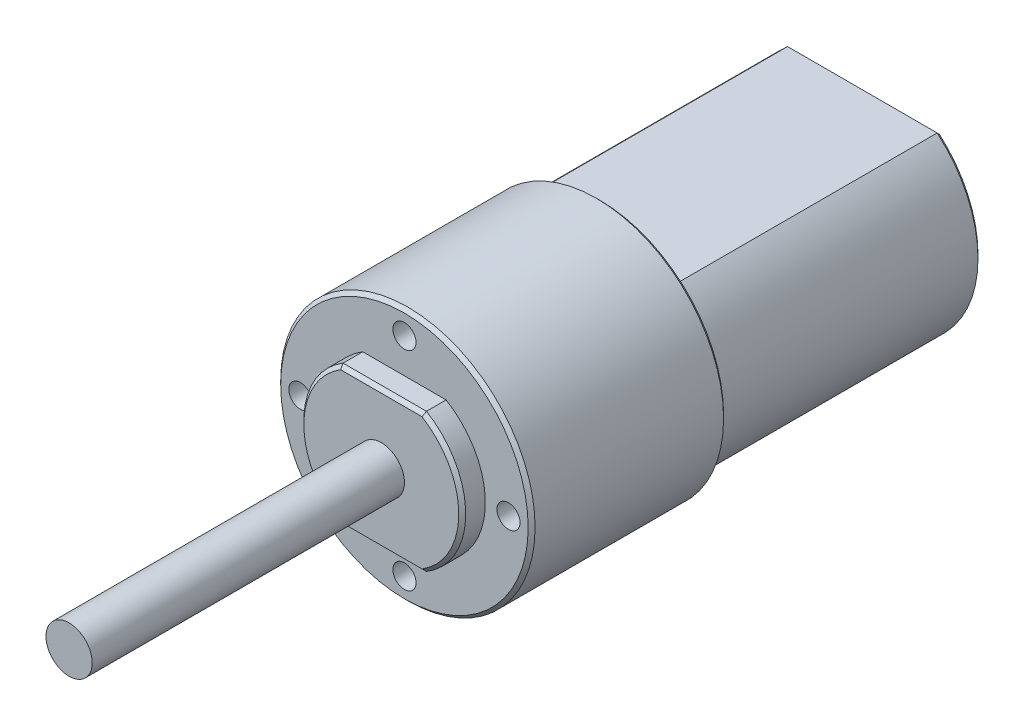
from build123d import *

# Parameters (mm, degrees)
CUT_EXTRUDE1_DEPTH = 23
SKETCH3_R          = 1
CUT_EXTRUDE2_DEPTH = 10
CUT_EXTRUDE3_START = -2
CUT_EXTRUDE3_DEPTH = 2
CHAMFER1_SIZE      = 0.3


with BuildPart() as part:
    # Sketch1 → Revolve1 (revolve)
    with BuildSketch(Plane(origin=(0, 0, 0), x_dir=(1, 0, 0), z_dir=(0, 1, 0)), mode=Mode.PRIVATE) as revolve1_sk:
        Polygon((-2, -29), (-2, -2), (-7, -2), (-7, 0), (-11, 0), (-11, 16.9), (-10, 16.9), (-10, 39.9), (0, 39.9), (0, -29), align=None)
    revolve(revolve1_sk.sketch.rotate(Axis((0, 0, -0.287466161), (0, 0, -1)), 180), axis=Axis((0, 0, -0.287466161), (0, 0, -1)))

    # Sketch2 → Cut-Extrude1 (cut)
    with BuildSketch(Plane(origin=(0, 0, -39.9), x_dir=(-1, 0, 0), z_dir=(0, 0, -1))):
        with BuildLine():
            ThreePointArc((6.469882147, 7.625), (0, 10), (-6.469882147, 7.625))
            Line((-6.469882147, 7.625), (6.469882147, 7.625))
        make_face()
        with BuildLine():
            Line((6.469882147, -7.625), (-6.469882147, -7.625))
            ThreePointArc((-6.469882147, -7.625), (0, -10), (6.469882147, -7.625))
        make_face()
    extrude(amount=-CUT_EXTRUDE1_DEPTH, mode=Mode.SUBTRACT)

    # Sketch3 → Cut-Extrude2 (cut)
    with BuildSketch(Plane.XY):
        with Locations((0, 9)):
            Circle(SKETCH3_R)
        with Locations((9, 0)):
            Circle(SKETCH3_R)
        with Locations((0, -9)):
            Circle(SKETCH3_R)
        with Locations((-9, 0)):
            Circle(SKETCH3_R)
    extrude(amount=-CUT_EXTRUDE2_DEPTH, mode=Mode.SUBTRACT)

    # Sketch4 → Cut-Extrude3 (cut)
    with BuildSketch(Plane.XY.offset(2).offset(CUT_EXTRUDE3_START)):
        with BuildLine():
            ThreePointArc((3.605551275, 6), (0, 7), (-3.605551275, 6))
            Line((-3.605551275, 6), (3.605551275, 6))
        make_face()
        with BuildLine():
            Line((3.605551275, -6), (-3.605551275, -6))
            ThreePointArc((-3.605551275, -6), (0, -7), (3.605551275, -6))
        make_face()
    extrude(amount=CUT_EXTRUDE3_DEPTH, mode=Mode.SUBTRACT)

    # Chamfer1
    chamfer1_edges = [part.edges().sort_by_distance(p)[0] for p in [
        (-11, 0, 0),
        (-10, 0, -39.9),
        (10, 0, -39.9),
        (0, 7.625, -39.9),
        (0, -7.625, -39.9),
        (-7, 0, 2),
        (7, 0, 2),
        (0, 6, 2),
        (0, -6, 2),
        (-11, 0, -16.9),
    ]]
    chamfer(chamfer1_edges, length=CHAMFER1_SIZE)


solid = part.part
